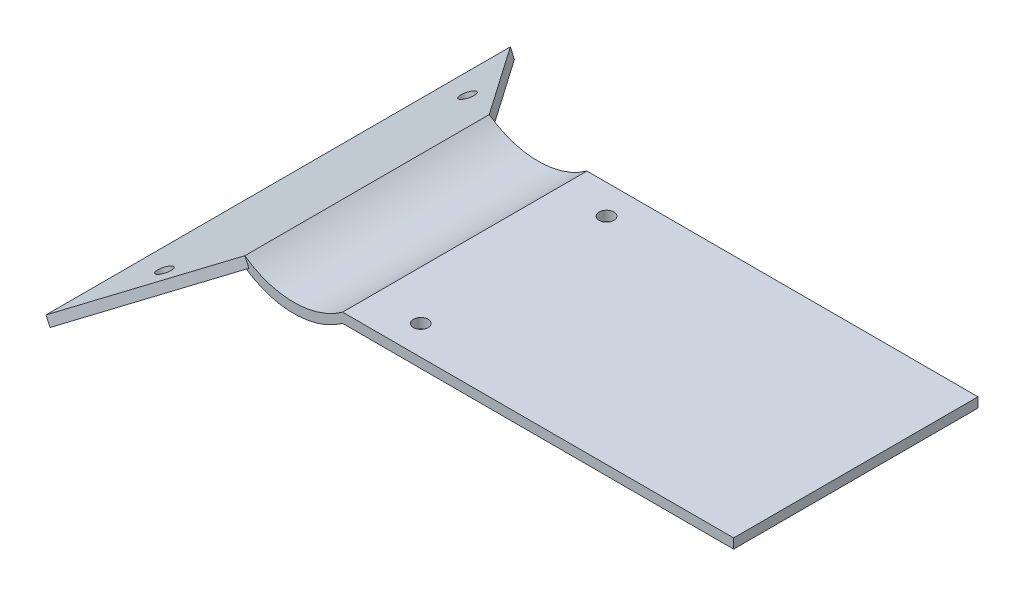
from build123d import *

# Parameters (mm, degrees)
SKETCH_1_W          = 800
SKETCH_1_H          = 20
EXTRUDE_1_DEPTH     = 500
SKETCH_3_R          = 15
EXTRUDE_2_DEPTH     = 20
SKETCH_5_R          = 15
CUT_EXTRUDE_2_DEPTH = 1100.74273844


with BuildPart() as part:
    # 草图1 → 凸台-拉伸1 (new body)
    with BuildSketch(Plane.XY):
        Rectangle(SKETCH_1_W, SKETCH_1_H)
        with BuildLine():
            ThreePointArc((-600, 10), (-500, -22.522729151), (-400, 10))
            Line((-400, 10), (-400, -10))
            ThreePointArc((-400, -10), (-500, -42.522729151), (-600, -10))
            Line((-600, -10), (-600, 10))
        make_face()
        Polygon((-600, 10), (-781.811868577, -73.333333333), (-818.174242293, -110), (-600, -10), align=None)
    extrude(amount=EXTRUDE_1_DEPTH)

    # 草图3 → 凸台-拉伸2 (add)
    # profile 1 of 2: a face of its own
    with BuildSketch(Plane(origin=(-107.954413929, 235.52872461, 0), x_dir=(0.9090593428863094, 0.41666666666666713, 0), z_dir=(-0.41666666666666713, 0.9090593428863094, 0))):
        Polygon((-741.268939065, 0), (-541.268939065, 0), (-741.268939065, 225), align=None)
        with Locations(Location((-656.268939065, 60, 0), (0, 0, 180))):
            Circle(SKETCH_3_R, mode=Mode.SUBTRACT)
    # profile 2 of 2: a face of its own
    with BuildSketch(Plane(origin=(-107.954413929, 235.52872461, 0), x_dir=(0.9090593428863094, 0.41666666666666713, 0), z_dir=(-0.41666666666666713, 0.9090593428863094, 0))):
        Polygon((-741.268939065, -725), (-541.268939065, -500), (-741.268939065, -500), align=None)
        with Locations(Location((-656.268939065, -560, 0), (0, 0, 180))):
            Circle(SKETCH_3_R, mode=Mode.SUBTRACT)
    extrude(amount=-EXTRUDE_2_DEPTH)

    # 草图5 → 切除-拉伸2 (cut, through all)
    with BuildSketch(Plane(origin=(0, 10, 0), x_dir=(1, 0, 0), z_dir=(0, 1, 0))):
        with Locations(Location((-300, -440, 0), (0, 0, 180))):
            Circle(SKETCH_5_R)
        with Locations(Location((-300, -60, 0), (0, 0, 180))):
            Circle(SKETCH_5_R)
    extrude(amount=-CUT_EXTRUDE_2_DEPTH, mode=Mode.SUBTRACT)


solid = part.part
